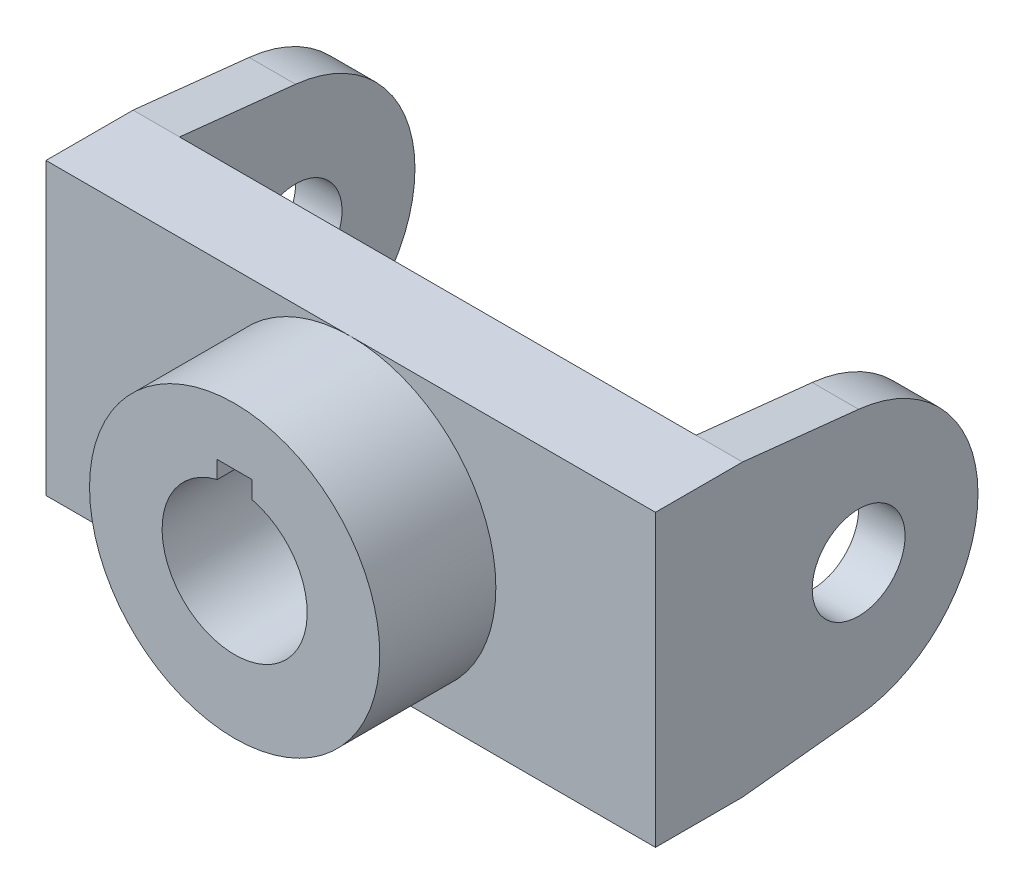
from build123d import *

# Parameters (mm, degrees)
SKETCH1_W           = 105
SKETCH1_H           = 50
BOSS_EXTRUDE1_DEPTH = 15
SKETCH4_R           = 8
BOSS_EXTRUDE2_DEPTH = 8
SKETCH5_R           = 25
BOSS_EXTRUDE3_DEPTH = 20


with BuildPart() as part:
    # Sketch1 → Boss-Extrude1 (new body)
    with BuildSketch(Plane.XY):
        Rectangle(SKETCH1_W, SKETCH1_H)
    extrude(amount=BOSS_EXTRUDE1_DEPTH)

    # Sketch4 → Boss-Extrude2 (add)
    with BuildSketch(Plane.ZY.offset(52.5)):
        with BuildLine():
            Line((0, -25), (0, 25))
            Line((0, 25), (-20, 22.870754113))
            ThreePointArc((-20, 22.870754113), (-40.565127043, 0), (-20, -22.870754113))
            Line((-20, -22.870754113), (0, -25))
        make_face()
        with Locations(Location((-20, 0, 0), (0, 0, 270))):
            Circle(SKETCH4_R, mode=Mode.SUBTRACT)
    boss_extrude2 = extrude(amount=-BOSS_EXTRUDE2_DEPTH)

    # Mirror1: Boss-Extrude2 across plane
    add(boss_extrude2.mirror(Plane(origin=(0, 0, 0), x_dir=(0, 0, 1), z_dir=(1, 0, 0))))

    # Sketch5 → Boss-Extrude3 (add)
    with BuildSketch(Plane.XY.offset(15)):
        with Locations(Location((0, 0, 0), (0, 0, 270))):
            Circle(SKETCH5_R)
        with BuildLine():
            Line((3, 12.1346611), (3, 15.1346611))
            Line((3, 15.1346611), (-3, 15.1346611))
            Line((-3, 15.1346611), (-3, 12.1346611))
            ThreePointArc((-3, 12.1346611), (0, -12.5), (3, 12.1346611))
        make_face(mode=Mode.SUBTRACT)
    extrude(amount=BOSS_EXTRUDE3_DEPTH)


solid = part.part
